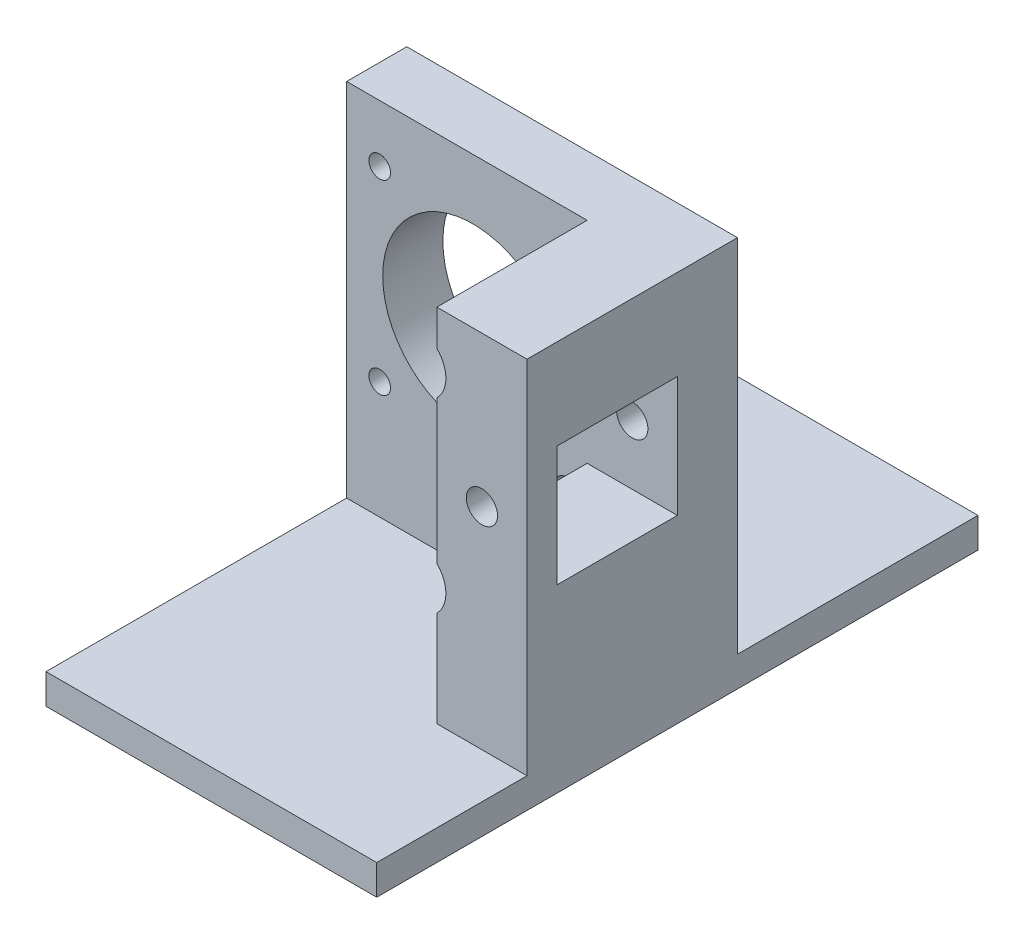
from build123d import *

# Parameters (mm, degrees)
SKETCH4_W               = 40
SKETCH4_H               = 80
BOSS_EXTRUDE4_DEPTH     = 5
SKETCH5_W               = 10
SKETCH5_H               = 5
BOSS_EXTRUDE6_DEPTH     = 50
SKETCH7_W               = 10
SKETCH7_H               = 25
SKETCH7_H_2             = 5
BOSS_EXTRUDE7_DEPTH     = 20
SKETCH8_W               = 40
SKETCH8_H               = 5
BOSS_EXTRUDE8_DEPTH     = 20
SKETCH9_W               = 100
SKETCH9_H               = 5
BOSS_EXTRUDE9_DEPTH     = 10
SKETCH10_W              = 5
SKETCH10_H              = 50
BOSS_EXTRUDE10_DEPTH    = 40
BOSS_EXTRUDE11_DEPTH    = 10
SKETCH12_R              = 15
SKETCH12_R_2            = 1.8
CUT_EXTRUDE1_DEPTH      = 5
CUT_EXTRUDE2_DEPTH      = 92.241437954
CUT_EXTRUDE2_DEPTH_BACK = 92.241437954
SKETCH13_R              = 2.25
SKETCH14_R              = 4
SKETCH14_R_2            = 2.25
CUT_EXTRUDE4_DEPTH      = 2
CUT_EXTRUDE5_START      = -2
SKETCH15_R              = 4
SKETCH15_R_2            = 2.25
CUT_EXTRUDE5_DEPTH      = 2
SKETCH17_R              = 5
CUT_EXTRUDE6_DEPTH      = 25
SKETCH19_W              = 50
SKETCH19_H              = 60
SKETCH19_R              = 1.8
SKETCH19_R_2            = 15
SKETCH19_R_3            = 4
BOSS_EXTRUDE13_DEPTH    = 5
SKETCH20_R              = 4
SKETCH20_R_2            = 2.25
BOSS_EXTRUDE14_DEPTH    = 5
SKETCH21_W              = 20
SKETCH21_H              = 20
BOSS_EXTRUDE15_DEPTH    = 5
BOSS_EXTRUDE16_START    = -10
SKETCH22_R              = 4
BOSS_EXTRUDE16_DEPTH    = 10
SKETCH23_R              = 4
BOSS_EXTRUDE17_DEPTH    = 5
CUT_EXTRUDE7_DEPTH      = 106.59356041
CUT_EXTRUDE7_DEPTH_BACK = 106.59356041
SKETCH24_R              = 2.6


with BuildPart() as part:
    # Sketch4 → Boss-Extrude4 (new body)
    with BuildSketch(Plane(origin=(0, 0, 0), x_dir=(1, 0, 0), z_dir=(0, 1, 0))):
        with Locations((20, 40)):
            Rectangle(SKETCH4_W, SKETCH4_H)
    extrude(amount=BOSS_EXTRUDE4_DEPTH)

    # Sketch5 → Boss-Extrude6 (add)
    with BuildSketch(Plane(origin=(0, 5, 0), x_dir=(1, 0, 0), z_dir=(0, 1, 0))):
        with Locations((35, 52.5)):
            Rectangle(SKETCH5_W, SKETCH5_H)
        with Locations((35, 27.5)):
            Rectangle(SKETCH5_W, SKETCH5_H)
    extrude(amount=BOSS_EXTRUDE6_DEPTH)

    # Sketch7 → Boss-Extrude7 (add)
    with BuildSketch(Plane.XY.offset(-50)):
        with Locations((35, 17.5)):
            Rectangle(SKETCH7_W, SKETCH7_H)
        with Locations((35, 52.5)):
            Rectangle(SKETCH7_W, SKETCH7_H_2)
    extrude(amount=BOSS_EXTRUDE7_DEPTH)

    # Sketch8 → Boss-Extrude8 (add)
    with BuildSketch(Plane(origin=(0, 0, -80), x_dir=(-1, 0, 0), z_dir=(0, 0, -1))):
        with Locations((-20, 2.5)):
            Rectangle(SKETCH8_W, SKETCH8_H)
    extrude(amount=BOSS_EXTRUDE8_DEPTH)

    # Sketch9 → Boss-Extrude9 (add)
    with BuildSketch(Plane.ZY):
        with Locations((-50, 2.5)):
            Rectangle(SKETCH9_W, SKETCH9_H)
    extrude(amount=BOSS_EXTRUDE9_DEPTH)

    # Sketch10 → Boss-Extrude10 (add)
    with BuildSketch(Plane.ZY.offset(-30)):
        with Locations((-52.5, 30)):
            Rectangle(SKETCH10_W, SKETCH10_H)
    extrude(amount=BOSS_EXTRUDE10_DEPTH)

    # Sketch11 → Boss-Extrude11 (add)
    with BuildSketch(Plane(origin=(0, 55, 0), x_dir=(1, 0, 0), z_dir=(0, 1, 0))):
        Polygon((40, 55), (-10, 55), (-10, 50), (30, 50), (30, 25), (40, 25), align=None)
    extrude(amount=BOSS_EXTRUDE11_DEPTH)

    # Sketch12 → Cut-Extrude1 (cut)
    with BuildSketch(Plane.XY.offset(-50)):
        with Locations((11, 40)):
            Circle(SKETCH12_R)
        with Locations((-4.499780644, 55.499780644)):
            Circle(SKETCH12_R_2)
        with Locations((26.499780644, 55.499780644)):
            Circle(SKETCH12_R_2)
        with Locations((-4.499780644, 24.500219356)):
            Circle(SKETCH12_R_2)
        with Locations((26.499780644, 24.500219356)):
            Circle(SKETCH12_R_2)
    extrude(amount=-CUT_EXTRUDE1_DEPTH, mode=Mode.SUBTRACT)

    # Sketch13 → Cut-Extrude2 (cut, two sides: drawn at the far end of the back side and taken through both)
    with BuildSketch(Plane.XY.offset(-50).offset(-CUT_EXTRUDE2_DEPTH_BACK)):
        with Locations((35, 40)):
            Circle(SKETCH13_R)
    extrude(amount=CUT_EXTRUDE2_DEPTH + CUT_EXTRUDE2_DEPTH_BACK, mode=Mode.SUBTRACT)

    # Sketch14 → Cut-Extrude4 (cut)
    with BuildSketch(Plane.XY.offset(-25)):
        with Locations((35, 40)):
            Circle(SKETCH14_R)
        with Locations((35, 40)):
            Circle(SKETCH14_R_2, mode=Mode.SUBTRACT)
    extrude(amount=-CUT_EXTRUDE4_DEPTH, mode=Mode.SUBTRACT)

    # Sketch15 → Cut-Extrude5 (cut)
    with BuildSketch(Plane(origin=(0, 0, -55), x_dir=(-1, 0, 0), z_dir=(0, 0, -1)).offset(CUT_EXTRUDE5_START)):
        with Locations(Location((-35, 40, 0), (0, 0, 180))):
            Circle(SKETCH15_R)
        with Locations(Location((-35, 40, 0), (0, 0, 180))):
            Circle(SKETCH15_R_2, mode=Mode.SUBTRACT)
    extrude(amount=CUT_EXTRUDE5_DEPTH, mode=Mode.SUBTRACT)

    # Sketch17 → Cut-Extrude6 (cut)
    with BuildSketch(Plane.XY.offset(-25)):
        with Locations((26.499780644, 55.499780644)):
            Circle(SKETCH17_R)
        with Locations((26.499780644, 24.500219356)):
            Circle(SKETCH17_R)
    extrude(amount=-CUT_EXTRUDE6_DEPTH, mode=Mode.SUBTRACT)

    # Sketch19 → Boss-Extrude13 (add)
    with BuildSketch(Plane(origin=(0, 0, -55), x_dir=(-1, 0, 0), z_dir=(0, 0, -1))):
        with Locations((-15, 35)):
            Rectangle(SKETCH19_W, SKETCH19_H)
        with Locations(Location((4.499780644, 55.499780644, 0), (0, 0, 180))):
            Circle(SKETCH19_R, mode=Mode.SUBTRACT)
        with Locations(Location((4.499780644, 24.500219356, 0), (0, 0, 180))):
            Circle(SKETCH19_R, mode=Mode.SUBTRACT)
        with Locations(Location((-26.499780644, 24.500219356, 0), (0, 0, 180))):
            Circle(SKETCH19_R, mode=Mode.SUBTRACT)
        with Locations(Location((-11, 40, 0), (0, 0, 180))):
            Circle(SKETCH19_R_2, mode=Mode.SUBTRACT)
        with Locations(Location((-35, 40, 0), (0, 0, 180))):
            Circle(SKETCH19_R_3, mode=Mode.SUBTRACT)
        with Locations(Location((-26.499780644, 55.499780644, 0), (0, 0, 180))):
            Circle(SKETCH19_R, mode=Mode.SUBTRACT)
    extrude(amount=BOSS_EXTRUDE13_DEPTH)

    # Sketch20 → Boss-Extrude14 (add)
    with BuildSketch(Plane(origin=(0, 0, -53), x_dir=(-1, 0, 0), z_dir=(0, 0, -1))):
        with Locations(Location((-35, 40, 0), (0, 0, 180))):
            Circle(SKETCH20_R)
        with Locations(Location((-35, 40, 0), (0, 0, 180))):
            Circle(SKETCH20_R_2, mode=Mode.SUBTRACT)
    extrude(amount=BOSS_EXTRUDE14_DEPTH)

    # Sketch21 → Boss-Extrude15 (add)
    with BuildSketch(Plane(origin=(40, 0, 0), x_dir=(0, 0, -1), z_dir=(1, 0, 0))):
        Polygon((100, 5), (60, 5), (60, 65), (25, 65), (25, 5), (0, 5), (0, 0), (100, 0), align=None)
        with Locations((40, 40)):
            Rectangle(SKETCH21_W, SKETCH21_H, mode=Mode.SUBTRACT)
    extrude(amount=BOSS_EXTRUDE15_DEPTH)

    # Sketch22 → Boss-Extrude16 (add)
    with BuildSketch(Plane(origin=(0, 0, -60), x_dir=(-1, 0, 0), z_dir=(0, 0, -1)).offset(BOSS_EXTRUDE16_START)):
        with Locations(Location((-35, 40, 0), (0, 0, 180))):
            Circle(SKETCH22_R)
    extrude(amount=BOSS_EXTRUDE16_DEPTH)

    # Sketch23 → Boss-Extrude17 (add)
    with BuildSketch(Plane.XY.offset(-25)):
        with Locations((35, 40)):
            Circle(SKETCH23_R)
    extrude(amount=-BOSS_EXTRUDE17_DEPTH)

    # Sketch24 → Cut-Extrude7 (cut, two sides: drawn at the far end of the back side and taken through both)
    with BuildSketch(Plane(origin=(0, 0, -30), x_dir=(-1, 0, 0), z_dir=(0, 0, -1)).offset(-CUT_EXTRUDE7_DEPTH_BACK)):
        with Locations((-37.5, 40)):
            Circle(SKETCH24_R)
    extrude(amount=CUT_EXTRUDE7_DEPTH + CUT_EXTRUDE7_DEPTH_BACK, mode=Mode.SUBTRACT)


solid = part.part
